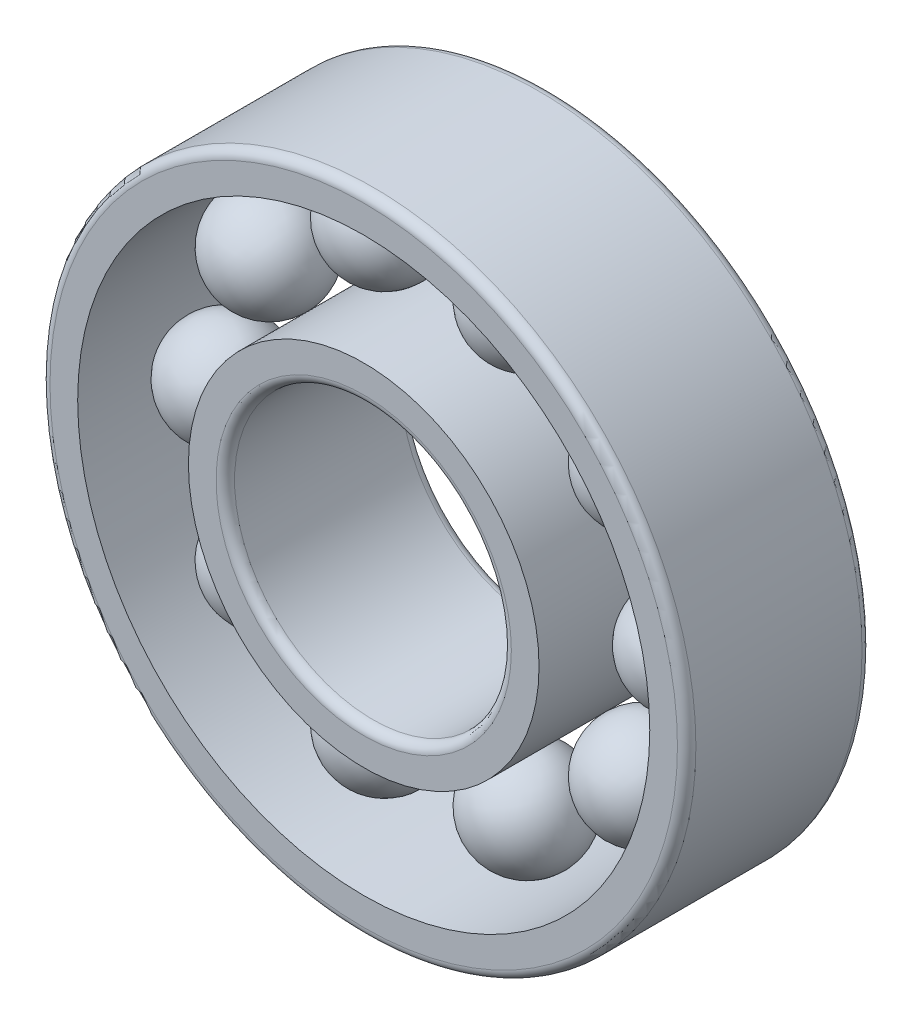
from build123d import *

# Parameters (mm, degrees)
INNERS_W           = 0.4
INNERS_H           = 2
OUTERS_W           = 0.4
OUTERS_H           = 2
BALLSPATTERN_COUNT = 10
FILLET_F1_R        = 0.1
FILLET_F2_R        = 0.1


with BuildPart() as part:
    # InnerS → InnerRing (revolve)
    with BuildSketch(Plane(origin=(0, 0, 0), x_dir=(1, 0, 0), z_dir=(0, 1, 0))):
        with Locations((1.7, 0)):
            Rectangle(INNERS_W, INNERS_H)
    revolve(axis=Axis((0, 0, 2.5), (0, 0, -1)))

    # Fillet F1
    fillet_f1_edges = [part.edges().sort_by_distance(p)[0] for p in [
        (-1.5, 0, -1),
        (-1.5, 0, 1),
    ]]
    fillet(fillet_f1_edges, radius=FILLET_F1_R)


with BuildPart() as body_2:
    # OuterS → OuterRing (revolve)
    with BuildSketch(Plane(origin=(0, 0, 0), x_dir=(1, 0, 0), z_dir=(0, 1, 0))):
        with Locations((3.3, 0)):
            Rectangle(OUTERS_W, OUTERS_H)
    revolve(axis=Axis((0, 0, 2.5), (0, 0, -1)))

    # Fillet F2
    fillet_f2_edges = [body_2.edges().sort_by_distance(p)[0] for p in [
        (-3.5, 0, -1),
        (-3.5, 0, 1),
    ]]
    fillet(fillet_f2_edges, radius=FILLET_F2_R)


with BuildPart() as body_3:
    # BallS → Ball (revolve)
    with BuildSketch(Plane(origin=(0, 0, 0), x_dir=(1, 0, 0), z_dir=(0, 1, 0))):
        with BuildLine():
            Line((1.93, 0), (3.07, 0))
            ThreePointArc((3.07, 0), (2.5, -0.57), (1.93, 0))
        make_face()
    revolve(axis=Axis((1.93, 0, 0), (1, 0, 0)))


with BuildPart() as ballspattern_1:
    # BallsPattern: pattern copy
    add(body_3.part.rotate(Axis((0, 0, -1.1), (0, 0, 1)), 1 * 360 / BALLSPATTERN_COUNT))


with BuildPart() as ballspattern_2:
    # BallsPattern: pattern copy
    add(body_3.part.rotate(Axis((0, 0, -1.1), (0, 0, 1)), 2 * 360 / BALLSPATTERN_COUNT))


with BuildPart() as ballspattern_3:
    # BallsPattern: pattern copy
    add(body_3.part.rotate(Axis((0, 0, -1.1), (0, 0, 1)), 3 * 360 / BALLSPATTERN_COUNT))


with BuildPart() as ballspattern_4:
    # BallsPattern: pattern copy
    add(body_3.part.rotate(Axis((0, 0, -1.1), (0, 0, 1)), 4 * 360 / BALLSPATTERN_COUNT))


with BuildPart() as ballspattern_5:
    # BallsPattern: pattern copy
    add(body_3.part.rotate(Axis((0, 0, -1.1), (0, 0, 1)), 5 * 360 / BALLSPATTERN_COUNT))


with BuildPart() as ballspattern_6:
    # BallsPattern: pattern copy
    add(body_3.part.rotate(Axis((0, 0, -1.1), (0, 0, 1)), 6 * 360 / BALLSPATTERN_COUNT))


with BuildPart() as ballspattern_7:
    # BallsPattern: pattern copy
    add(body_3.part.rotate(Axis((0, 0, -1.1), (0, 0, 1)), 7 * 360 / BALLSPATTERN_COUNT))


with BuildPart() as ballspattern_8:
    # BallsPattern: pattern copy
    add(body_3.part.rotate(Axis((0, 0, -1.1), (0, 0, 1)), 8 * 360 / BALLSPATTERN_COUNT))


with BuildPart() as ballspattern_9:
    # BallsPattern: pattern copy
    add(body_3.part.rotate(Axis((0, 0, -1.1), (0, 0, 1)), 9 * 360 / BALLSPATTERN_COUNT))


solid = Compound([part.part, body_2.part, body_3.part, ballspattern_1.part, ballspattern_2.part, ballspattern_3.part, ballspattern_4.part, ballspattern_5.part, ballspattern_6.part, ballspattern_7.part, ballspattern_8.part, ballspattern_9.part])
